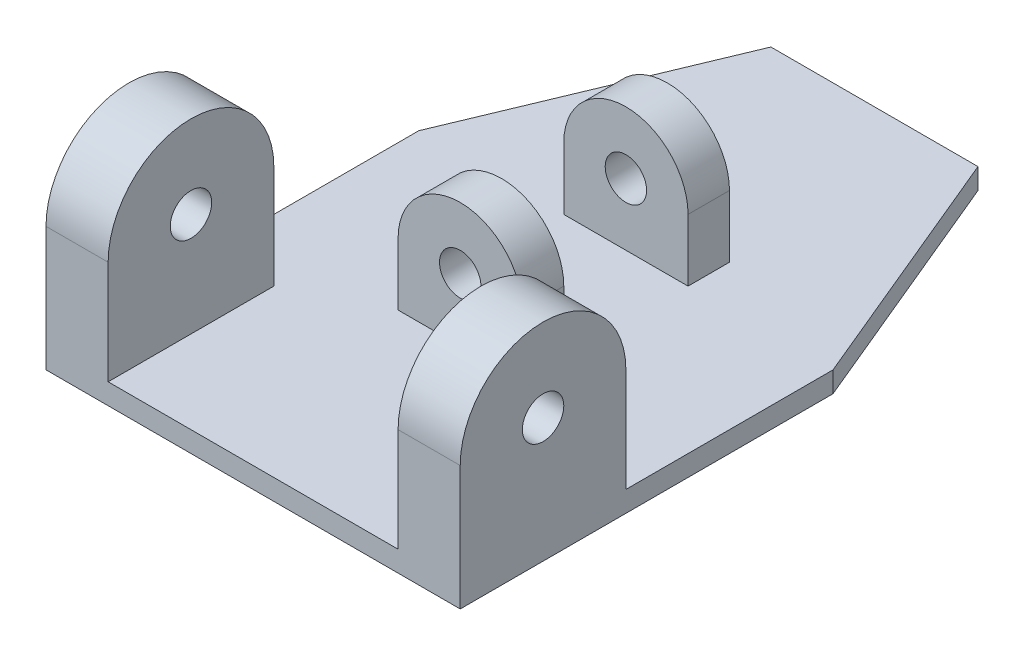
from build123d import *

# Parameters (mm, degrees)
EXTRUDE_1_DEPTH     = 10
EXTRUDE_2_DEPTH     = 200
SKETCH_3_W          = 140
SKETCH_3_H          = 100
CUT_EXTRUDE_1_DEPTH = 171
EXTRUDE_START       = -100
EXTRUDE_3_DEPTH     = 100
SKETCH_5_W          = 80
SKETCH_5_H          = 60
CUT_EXTRUDE_2_DEPTH = 110


with BuildPart() as part:
    # 草图1 → 凸台-拉伸1 (new body)
    with BuildSketch(Plane(origin=(0, 0, 0), x_dir=(1, 0, 0), z_dir=(0, 1, 0))):
        Polygon((-100, 0), (100, 0), (100, 180), (50, 300), (-50, 300), (-100, 180), align=None)
    extrude(amount=EXTRUDE_1_DEPTH)

    # 草图2 → 凸台-拉伸2 (add)
    with BuildSketch(Plane(origin=(100, 0, 0), x_dir=(0, 0, -1), z_dir=(1, 0, 0))):
        with BuildLine():
            ThreePointArc((80, 60), (68.284271247, 88.284271247), (40, 100))
            Line((40, 100), (40, 70))
            ThreePointArc((40, 70), (47.071067812, 67.071067812), (50, 60))
            ThreePointArc((50, 60), (47.071067812, 52.928932188), (40, 50))
            Line((40, 50), (40, 10))
            Line((40, 10), (80, 10))
            Line((80, 10), (80, 60))
        make_face()
        with BuildLine():
            Line((40, 70), (40, 100))
            ThreePointArc((40, 100), (11.715728753, 88.284271247), (0, 60))
            Line((0, 60), (0, 10))
            Line((0, 10), (40, 10))
            Line((40, 10), (40, 50))
            ThreePointArc((40, 50), (30, 60), (40, 70))
        make_face()
    extrude(amount=-EXTRUDE_2_DEPTH)

    # 草图3 → 切除-拉伸1 (cut)
    with BuildSketch(Plane(origin=(0, 10, 0), x_dir=(1, 0, 0), z_dir=(0, 1, 0))):
        with Locations((0, 50)):
            Rectangle(SKETCH_3_W, SKETCH_3_H)
    extrude(amount=CUT_EXTRUDE_1_DEPTH, mode=Mode.SUBTRACT)

    # 草图4 → 凸台-拉伸3 (add)
    with BuildSketch(Plane.XY.offset(EXTRUDE_START)):
        with BuildLine():
            Line((0, 30), (0, 10))
            Line((0, 10), (30, 10))
            Line((30, 10), (30, 40))
            ThreePointArc((30, 40), (21.213203436, 61.213203436), (0, 70))
            Line((0, 70), (0, 50))
            ThreePointArc((0, 50), (7.071067812, 47.071067812), (10, 40))
            ThreePointArc((10, 40), (7.071067812, 32.928932188), (0, 30))
        make_face()
        with BuildLine():
            Line((-30, 10), (0, 10))
            Line((0, 10), (0, 30))
            ThreePointArc((0, 30), (-10, 40), (0, 50))
            Line((0, 50), (0, 70))
            ThreePointArc((0, 70), (-21.213203436, 61.213203436), (-30, 40))
            Line((-30, 40), (-30, 10))
        make_face()
    extrude(amount=-EXTRUDE_3_DEPTH)

    # 草图5 → 切除-拉伸2 (cut)
    with BuildSketch(Plane(origin=(0, 10, 0), x_dir=(1, 0, 0), z_dir=(0, 1, 0))):
        with Locations((0, 150)):
            Rectangle(SKETCH_5_W, SKETCH_5_H)
    extrude(amount=CUT_EXTRUDE_2_DEPTH, mode=Mode.SUBTRACT)


solid = part.part
